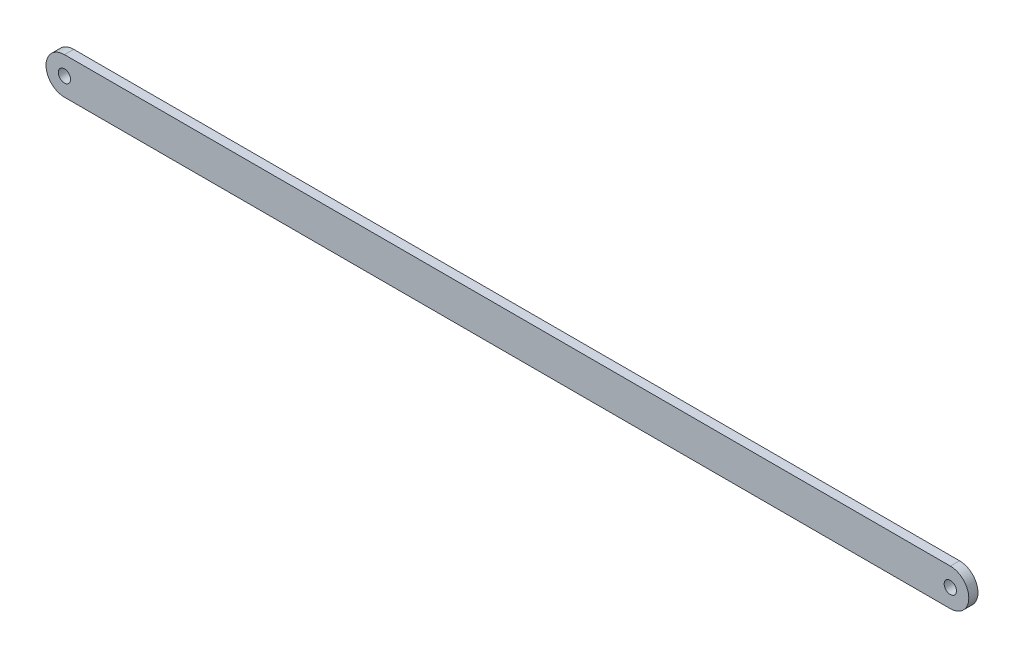
from build123d import *

# Parameters (mm, degrees)
SKETCH1_R           = 2
BOSS_EXTRUDE3_DEPTH = 3


with BuildPart() as part:
    # Sketch1 → Boss-Extrude3 (new body)
    with BuildSketch(Plane.XY):
        with BuildLine():
            Line((-35.312724167, 6), (252.687275833, 6))
            ThreePointArc((252.687275833, 6), (258.687275833, 0), (252.687275833, -6))
            Line((252.687275833, -6), (-35.312724167, -6))
            ThreePointArc((-35.312724167, -6), (-41.312724167, 0), (-35.312724167, 6))
        make_face()
        with Locations((-35.312724167, 0)):
            Circle(SKETCH1_R, mode=Mode.SUBTRACT)
        with Locations((252.687275833, 0)):
            Circle(SKETCH1_R, mode=Mode.SUBTRACT)
    extrude(amount=BOSS_EXTRUDE3_DEPTH)


solid = part.part
